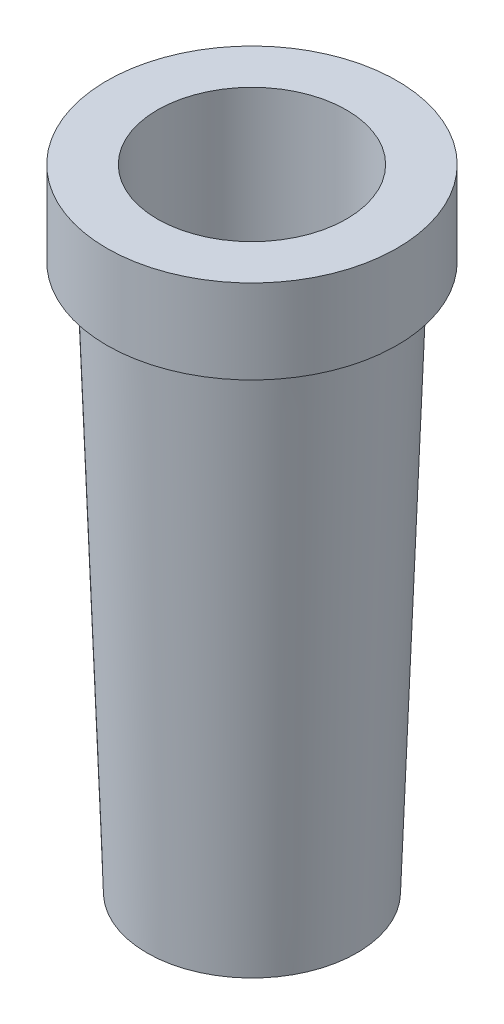
from build123d import *

# Parameters (mm, degrees)
M4_CLEARANCE_HOLE1_D = 4.5


with BuildPart() as part:
    # Sketch1 → Revolve1 (revolve)
    with BuildSketch(Plane.XY, mode=Mode.PRIVATE) as revolve1_sk:
        Polygon((0, 0), (2.5, 0), (2.953970003, 13), (3.453970003, 13), (3.453970003, 15), (0, 15), align=None)
    revolve(revolve1_sk.sketch.rotate(Axis((0, 15, 0), (0, -1, 0)), 90), axis=Axis((0, 15, 0), (0, -1, 0)))

    # M4 Clearance Hole1 (through all)
    with Locations(Plane(origin=(0, 15, 0), x_dir=(1, 0, 0), z_dir=(0, 1, 0))):
        with Locations((0, 0)):
            Hole(M4_CLEARANCE_HOLE1_D / 2)


solid = part.part
